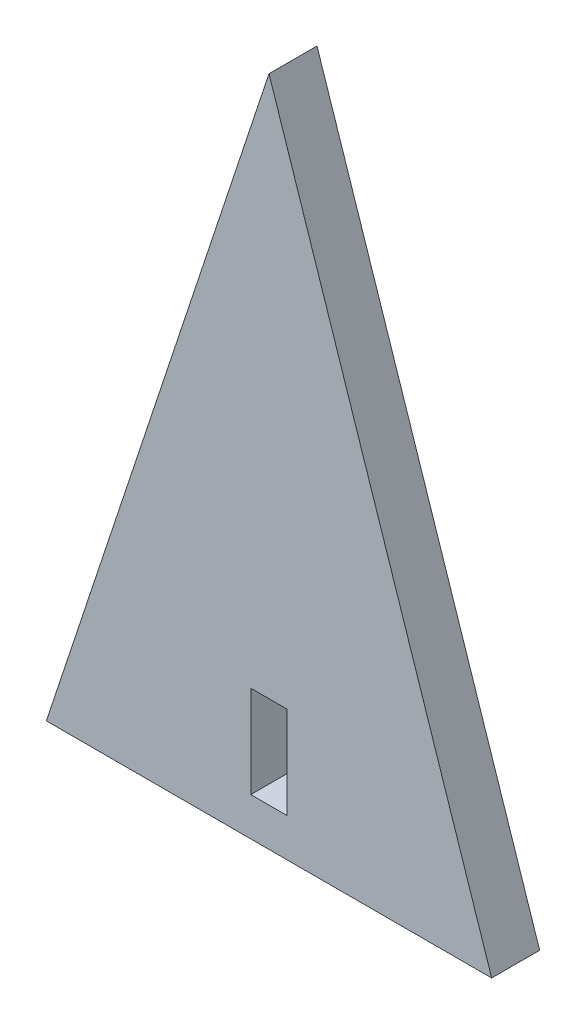
from build123d import *

# Parameters (mm, degrees)
SKETCH2_W           = 2.413
SKETCH2_H           = 6.096
BOSS_EXTRUDE1_DEPTH = 3.175


with BuildPart() as part:
    # Sketch2 → Boss-Extrude1 (new body)
    with BuildSketch(Plane.XY):
        Polygon((-16.084625597, -40.368802078), (-1.352625597, 4.081197922), (13.379374403, -40.368802078), align=None)
        with Locations((-1.352625597, -34.780802078)):
            Rectangle(SKETCH2_W, SKETCH2_H, mode=Mode.SUBTRACT)
    extrude(amount=BOSS_EXTRUDE1_DEPTH)


solid = part.part
